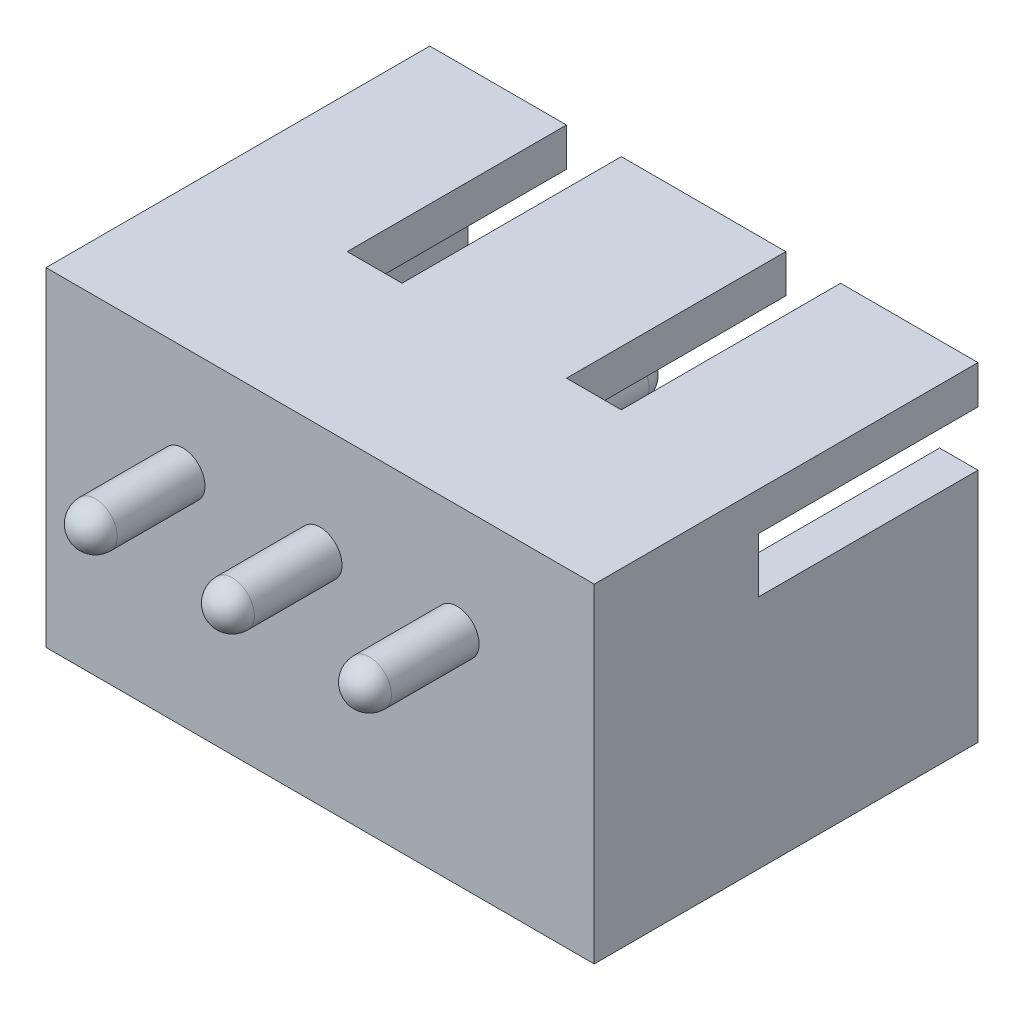
from build123d import *

# Parameters (mm, degrees)
SKETCH_1_W           = 10
SKETCH_1_H           = 6
EXTRUDE_1_DEPTH      = 7
SKETCH_2_W           = 8.6
SKETCH_2_H           = 4.6
CUT_EXTRUDE_1_DEPTH  = 5
CUT_EXTRUDE_2_REACH  = 15.601
SKETCH_3_W           = 1
SKETCH_3_H           = 4
SKETCH_4_W           = 4
SKETCH_4_H           = 1
CUT_EXTRUDE_3_DEPTH  = 14.601470509
EXTRUDE_2_DEPTH      = 4
EXTRUDE_2_DEPTH_BACK = 4
SKETCH_5_R           = 0.4
FILLET_1_R           = 0.4


with BuildPart() as part:
    # 草图1 → 凸台-拉伸1 (new body)
    with BuildSketch(Plane.XY):
        with Locations((5, 3)):
            Rectangle(SKETCH_1_W, SKETCH_1_H)
    extrude(amount=EXTRUDE_1_DEPTH)

    # 草图2 → 切除-拉伸1 (cut)
    with BuildSketch(Plane.XY):
        with Locations((5, 3)):
            Rectangle(SKETCH_2_W, SKETCH_2_H)
    extrude(amount=CUT_EXTRUDE_1_DEPTH, mode=Mode.SUBTRACT)

    # 草图3 → 切除-拉伸2 (cut, up to next)
    with BuildSketch(Plane(origin=(0, 6, 0), x_dir=(1, 0, 0), z_dir=(0, 1, 0)), mode=Mode.PRIVATE) as cut_extrude_2_sk1:
        with Locations((6.99408033, -2)):
            Rectangle(SKETCH_3_W, SKETCH_3_H)
    cut_extrude_2_tool1 = extrude(cut_extrude_2_sk1.sketch, amount=-CUT_EXTRUDE_2_REACH, mode=Mode.PRIVATE) & part.part
    # 草图3 → 切除-拉伸2 (cut, up to next)
    with BuildSketch(Plane(origin=(0, 6, 0), x_dir=(1, 0, 0), z_dir=(0, 1, 0)), mode=Mode.PRIVATE) as cut_extrude_2_sk2:
        with Locations((2.99408033, -2)):
            Rectangle(SKETCH_3_W, SKETCH_3_H)
    cut_extrude_2_tool2 = extrude(cut_extrude_2_sk2.sketch, amount=-CUT_EXTRUDE_2_REACH, mode=Mode.PRIVATE) & part.part
    add(cut_extrude_2_tool1.solids().sort_by_distance((6.99408, 6, 2))[0], mode=Mode.SUBTRACT)
    add(cut_extrude_2_tool2.solids().sort_by_distance((2.99408, 6, 2))[0], mode=Mode.SUBTRACT)

    # 草图4 → 切除-拉伸3 (cut, through all)
    with BuildSketch(Plane(origin=(10, 0, 0), x_dir=(0, 0, -1), z_dir=(1, 0, 0))):
        with Locations((-2, 4.8)):
            Rectangle(SKETCH_4_W, SKETCH_4_H)
    extrude(amount=-CUT_EXTRUDE_3_DEPTH, mode=Mode.SUBTRACT)

    # 草图5 → 凸台-拉伸2 (add, two sides: drawn at the far end of the back side and taken through both)
    with BuildSketch(Plane(origin=(0, 0, 5), x_dir=(-1, 0, 0), z_dir=(0, 0, -1)).offset(-EXTRUDE_2_DEPTH_BACK)):
        with Locations((-5, 4)):
            Circle(SKETCH_5_R)
        with Locations((-7.5, 4)):
            Circle(SKETCH_5_R)
        with Locations((-2.5, 4)):
            Circle(SKETCH_5_R)
    extrude(amount=EXTRUDE_2_DEPTH + EXTRUDE_2_DEPTH_BACK)

    # 圆角1
    fillet_1_edges = [part.edges().sort_by_distance(p)[0] for p in [
        (2.9, 4, 9),
        (2.9, 4, 1),
        (5.4, 4, 9),
        (5.4, 4, 1),
        (7.9, 4, 9),
        (7.9, 4, 1),
    ]]
    fillet(fillet_1_edges, radius=FILLET_1_R)


solid = part.part
